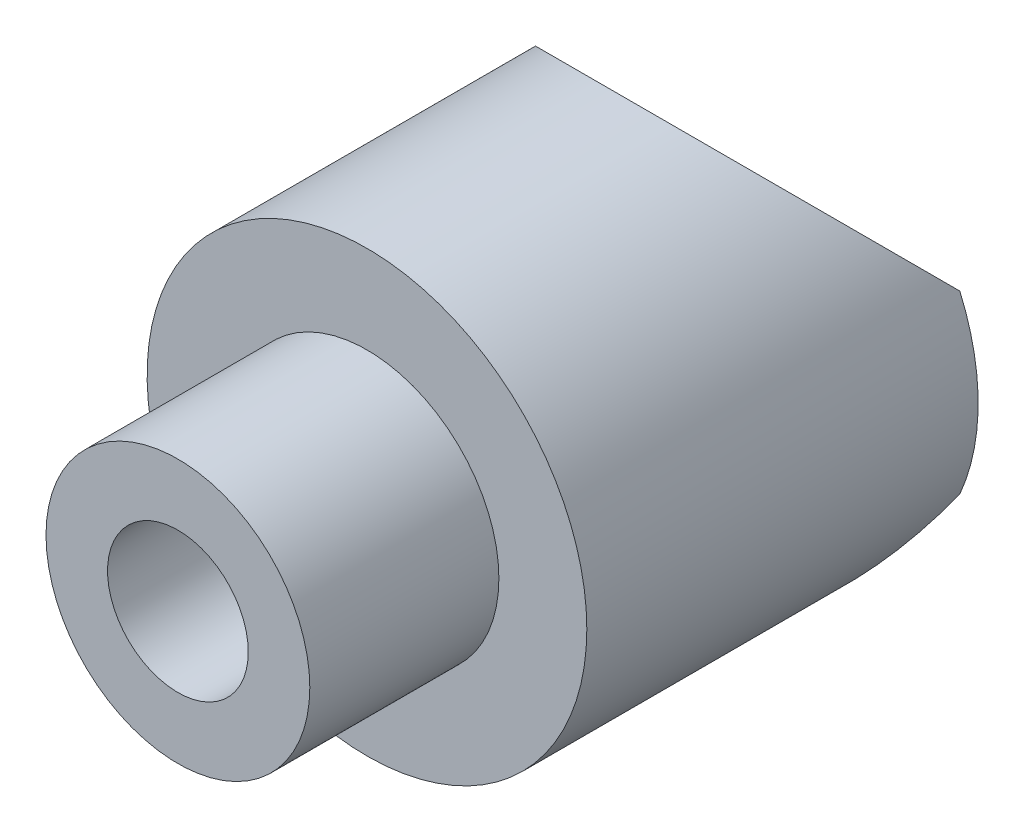
from build123d import *

# Parameters (mm, degrees)
SKETCH_1_R          = 5
EXTRUDE_1_DEPTH     = 15
CUT_EXTRUDE_START   = -4
SKETCH_2_R          = 5
SKETCH_2_R_2        = 3
CUT_EXTRUDE_1_DEPTH = 4
SKETCH_3_R          = 5
CUT_EXTRUDE_2_DEPTH = 25
SKETCH_4_R          = 1.6
CUT_EXTRUDE_3_DEPTH = 17.583123952
SKETCH_5_R          = 5
SKETCH_5_R_2        = 3
CUT_EXTRUDE_4_DEPTH = 2.1
SKETCH_6_OUTSIDE_W  = 16.124
SKETCH_6_OUTSIDE_H  = 16.124
SKETCH_6_OUTSIDE_R  = 3
CUT_EXTRUDE_5_DEPTH = 3
CUT_EXTRUDE_START_2 = -1.8
SKETCH_7_R          = 3
CUT_EXTRUDE_6_DEPTH = 1.8


with BuildPart() as part:
    # 草图1 → 凸台-拉伸1 (new body)
    with BuildSketch(Plane.XY):
        Circle(SKETCH_1_R)
    extrude(amount=EXTRUDE_1_DEPTH)

    # 草图2 → 切除-拉伸1 (cut)
    with BuildSketch(Plane.XY.offset(13).offset(CUT_EXTRUDE_START)):
        Circle(SKETCH_2_R)
        Circle(SKETCH_2_R_2, mode=Mode.SUBTRACT)
    extrude(amount=CUT_EXTRUDE_1_DEPTH, mode=Mode.SUBTRACT)

    # 草图3 → 切除-拉伸2 (cut, symmetric)
    with BuildSketch(Plane(origin=(0, 0, 0), x_dir=(1, 0, 0), z_dir=(0, 1, 0))):
        with Locations((0, 2)):
            Circle(SKETCH_3_R)
    extrude(amount=CUT_EXTRUDE_2_DEPTH, both=True, mode=Mode.SUBTRACT)

    # 草图4 → 切除-拉伸3 (cut, through all)
    with BuildSketch(Plane.XY.offset(15)):
        Circle(SKETCH_4_R)
    extrude(amount=-CUT_EXTRUDE_3_DEPTH, mode=Mode.SUBTRACT)

    # 草图5 → 切除-拉伸4 (cut, symmetric)
    with BuildSketch(Plane.XY.offset(11)):
        with Locations(Location((0, 0, 0), (0, 0, 203.578178478))):
            Circle(SKETCH_5_R)
        Circle(SKETCH_5_R_2, mode=Mode.SUBTRACT)
    extrude(amount=CUT_EXTRUDE_4_DEPTH, both=True, mode=Mode.SUBTRACT)

    # 草图6 outside → 切除-拉伸5 (cut)
    with BuildSketch(Plane.XY.offset(15)):
        Rectangle(SKETCH_6_OUTSIDE_W, SKETCH_6_OUTSIDE_H)
        Circle(SKETCH_6_OUTSIDE_R, mode=Mode.SUBTRACT)
    extrude(amount=-CUT_EXTRUDE_5_DEPTH, mode=Mode.SUBTRACT)

    # 草图7 → 切除-拉伸6 (cut)
    with BuildSketch(Plane.XY.offset(15).offset(CUT_EXTRUDE_START_2)):
        Circle(SKETCH_7_R)
    extrude(amount=CUT_EXTRUDE_6_DEPTH, mode=Mode.SUBTRACT)


solid = part.part
